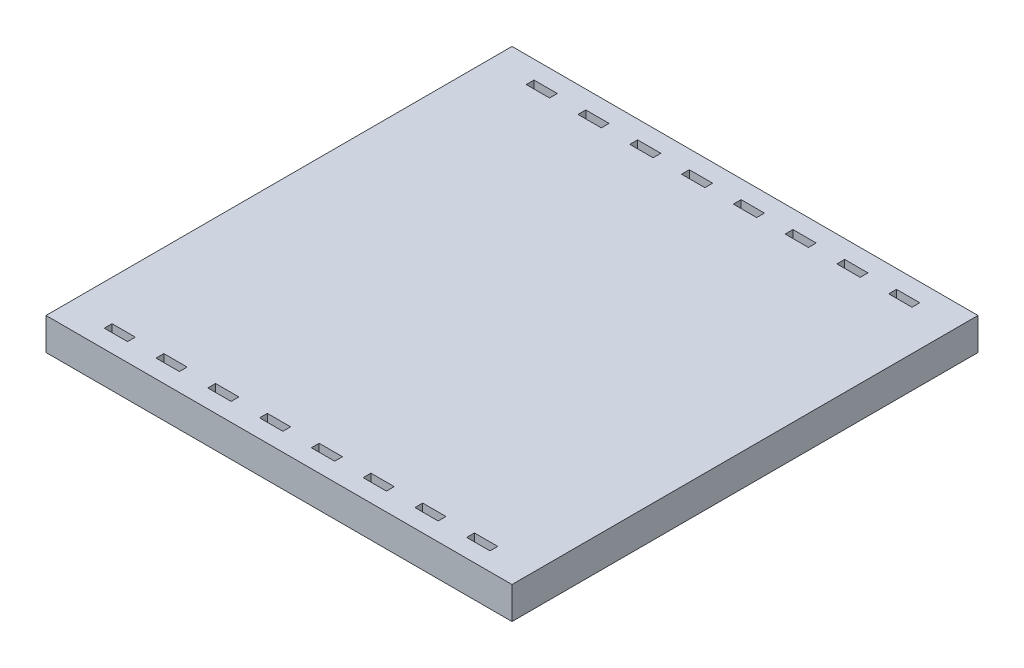
from build123d import *

# Parameters (mm, degrees)
OUTLINE_W           = 100
OUTLINE_H           = 100
BOSS_EXTRUDE1_DEPTH = 6.2
SKETCH3_OUTSIDE_W   = 130.312
SKETCH3_OUTSIDE_H   = 130.312
SKETCH3_OUTSIDE_W_2 = 90
SKETCH3_OUTSIDE_H_2 = 90
CUT_EXTRUDE2_DEPTH  = 128.430137723
SKETCH2_W           = 4.5
SKETCH2_H           = 1.5
CUT_EXTRUDE1_DEPTH  = 121.36793593
LPATTERN2_COUNT     = 8
LPATTERN2_PITCH     = 10


with BuildPart() as part:
    # Outline → Boss-Extrude1 (new body)
    with BuildSketch(Plane(origin=(0, 0, 0), x_dir=(1, 0, 0), z_dir=(0, 1, 0))):
        with Locations((40, -40)):
            Rectangle(OUTLINE_W, OUTLINE_H)
    extrude(amount=BOSS_EXTRUDE1_DEPTH)

    # Sketch3 outside → Cut-Extrude2 (cut, through all)
    with BuildSketch(Plane(origin=(0, 6.2, 0), x_dir=(1, 0, 0), z_dir=(0, 1, 0))):
        with Locations((40, -40)):
            Rectangle(SKETCH3_OUTSIDE_W, SKETCH3_OUTSIDE_H)
        with Locations((40, -40)):
            Rectangle(SKETCH3_OUTSIDE_W_2, SKETCH3_OUTSIDE_H_2, mode=Mode.SUBTRACT)
    extrude(amount=-CUT_EXTRUDE2_DEPTH, mode=Mode.SUBTRACT)

    # Sketch2 → Cut-Extrude1 (cut, through all)
    with BuildSketch(Plane(origin=(0, 6.2, 0), x_dir=(1, 0, 0), z_dir=(0, 1, 0))):
        with Locations((5, 0.75)):
            Rectangle(SKETCH2_W, SKETCH2_H)
        with Locations((5, -80.75)):
            Rectangle(SKETCH2_W, SKETCH2_H)
    cut_extrude1 = extrude(amount=-CUT_EXTRUDE1_DEPTH, mode=Mode.SUBTRACT)

    # LPattern2: Cut-Extrude1 ×8
    with Locations(*[(i * LPATTERN2_PITCH, 0, 0) for i in range(1, LPATTERN2_COUNT)]):
        add(cut_extrude1, mode=Mode.SUBTRACT)


solid = part.part
